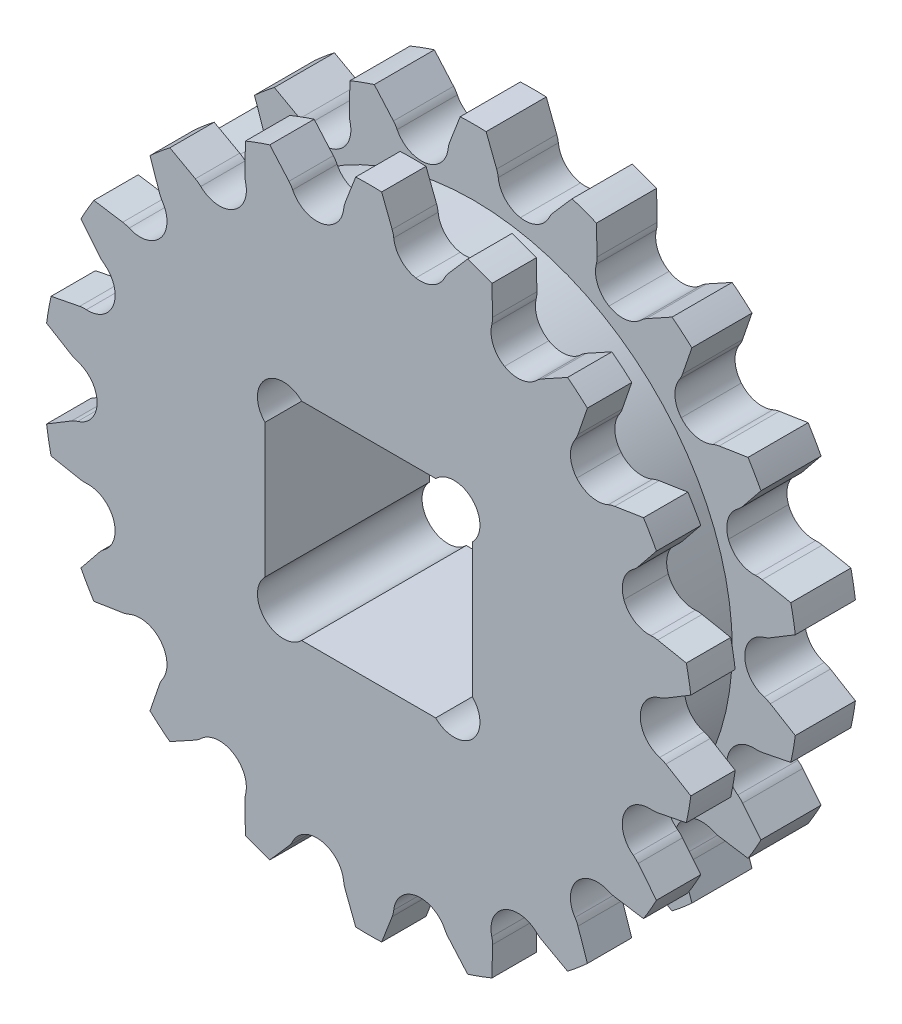
from build123d import *

# Parameters (mm, degrees)
BOSS_EXTRUDE1_DEPTH = 2.7178
SKETCH3_R           = 15.875
BOSS_EXTRUDE2_DEPTH = 3.683
BOSS_EXTRUDE3_START = -7.366
BOSS_EXTRUDE3_DEPTH = 3.683
CUT_EXTRUDE1_DEPTH  = 30.793258251


with BuildPart() as part:
    # Sketch1 → Boss-Extrude1 (new body)
    with BuildSketch(Plane.XY):
        with BuildLine():
            Line((-0.79375, 19.897774396), (-1.436590898, 18.231487888))
            ThreePointArc((-1.436590898, 18.231487888), (-1.498138247, 18.03477884), (-1.533681014, 17.831753627))
            ThreePointArc((-1.533681014, 17.831753627), (-1.969599997, 16.882094075), (-2.888368056, 16.384355312))
            ThreePointArc((-2.888368056, 16.384355312), (-3.922004552, 16.537943659), (-4.656380636, 17.281371903))
            ThreePointArc((-4.656380636, 17.281371903), (-4.759313465, 17.459923199), (-4.884510306, 17.623634786))
            Line((-4.884510306, 17.623634786), (-6.059558633, 18.969270258))
            ThreePointArc((-6.059558633, 18.969270258), (-6.810852326, 18.712662973), (-7.551320668, 18.426313281))
            Line((-7.551320668, 18.426313281), (-7.585489966, 16.640651609))
            ThreePointArc((-7.585489966, 16.640651609), (-7.576047099, 16.434755136), (-7.540007663, 16.231817498))
            ThreePointArc((-7.540007663, 16.231817498), (-7.624834818, 15.190336353), (-8.3179577, 14.408377726))
            ThreePointArc((-8.3179577, 14.408377726), (-9.341788597, 14.199179061), (-10.286143819, 14.646601681))
            ThreePointArc((-10.286143819, 14.646601681), (-10.443937178, 14.779179916), (-10.617576386, 14.890198645))
            Line((-10.617576386, 14.890198645), (-12.181995065, 15.752792171))
            ThreePointArc((-12.181995065, 15.752792171), (-12.800215344, 15.254702622), (-13.398090619, 14.732366841))
            Line((-13.398090619, 14.732366841), (-12.819466994, 13.042707157))
            ThreePointArc((-12.819466994, 13.042707157), (-12.74017286, 12.852457411), (-12.636898109, 12.674084624))
            ThreePointArc((-12.636898109, 12.674084624), (-12.36040203, 11.666399881), (-12.744278886, 10.694537142))
            ThreePointArc((-12.744278886, 10.694537142), (-13.634905925, 10.148174393), (-14.675246249, 10.245235136))
            ThreePointArc((-14.675246249, 10.245235136), (-14.868867931, 10.315849418), (-15.070006055, 10.360784792))
            Line((-15.070006055, 10.360784792), (-16.835103105, 10.636294862))
            ThreePointArc((-16.835103105, 10.636294862), (-17.245683481, 9.9568), (-17.628853105, 9.261479534))
            Line((-17.628853105, 9.261479534), (-16.507227108, 7.871619731))
            ThreePointArc((-16.507227108, 7.871619731), (-16.36764575, 7.71996364), (-16.209592142, 7.587670094))
            ThreePointArc((-16.209592142, 7.587670094), (-15.605122337, 6.735323405), (-15.633451952, 5.690777544))
            ThreePointArc((-15.633451952, 5.690777544), (-16.283500544, 4.872752113), (-17.294297398, 4.608142031))
            ThreePointArc((-17.294297398, 4.608142031), (-17.500393771, 4.608275234), (-17.704770585, 4.581707383))
            Line((-17.704770585, 4.581707383), (-19.457649251, 4.236903417))
            ThreePointArc((-19.457649251, 4.236903417), (-19.61106767, 3.457960351), (-19.733315733, 2.673521109))
            Line((-19.733315733, 2.673521109), (-18.203972012, 1.751098794))
            ThreePointArc((-18.203972012, 1.751098794), (-18.020939002, 1.65632832), (-17.827170135, 1.586070568))
            ThreePointArc((-17.827170135, 1.586070568), (-16.967634583, 0.991867524), (-16.636999988, 0.000626187))
            ThreePointArc((-16.636999988, 0.000626187), (-16.968064677, -0.990395986), (-17.827401045, -1.584761013))
            ThreePointArc((-17.827401045, -1.584761013), (-18.021113843, -1.655124954), (-18.204078487, -1.749991554))
            Line((-18.204078487, -1.749991554), (-19.733315733, -2.673521109))
            ThreePointArc((-19.733315733, -2.673521109), (-19.61106767, -3.457960351), (-19.457649251, -4.236903417))
            Line((-19.457649251, -4.236903417), (-17.705049229, -4.580630502))
            ThreePointArc((-17.705049229, -4.580630502), (-17.500641049, -4.60708464), (-17.294528308, -4.606832476))
            ThreePointArc((-17.294528308, -4.606832476), (-16.283599682, -4.871222219), (-15.63388029, -5.689600697))
            ThreePointArc((-15.63388029, -5.689600697), (-15.606029789, -6.734087713), (-16.21025702, -7.58651849))
            ThreePointArc((-16.21025702, -7.58651849), (-16.368221623, -7.718892645), (-16.50770586, -7.870615683))
            Line((-16.50770586, -7.870615683), (-17.628853105, -9.261479534))
            ThreePointArc((-17.628853105, -9.261479534), (-17.245683481, -9.9568), (-16.835103105, -10.636294862))
            Line((-16.835103105, -10.636294862), (-15.070636211, -10.359868156))
            ThreePointArc((-15.070636211, -10.359868156), (-14.869507504, -10.3148152), (-14.675911128, -10.244083533))
            ThreePointArc((-14.675911128, -10.244083533), (-13.63552234, -10.14677067), (-12.745083897, -10.693577767))
            ThreePointArc((-12.745083897, -10.693577767), (-12.361677388, -11.665549077), (-12.637916762, -12.673229872))
            ThreePointArc((-12.637916762, -12.673229872), (-12.741080306, -12.851647965), (-12.820260279, -13.041927403))
            Line((-12.820260279, -13.041927403), (-13.398090619, -14.732366841))
            ThreePointArc((-13.398090619, -14.732366841), (-12.800215344, -15.254702622), (-12.181995065, -15.752792171))
            Line((-12.181995065, -15.752792171), (-10.618482046, -14.889552815))
            ThreePointArc((-10.618482046, -14.889552815), (-10.444891903, -14.778426816), (-10.287162472, -14.64574693))
            ThreePointArc((-10.287162472, -14.64574693), (-9.342799764, -14.198468829), (-8.319042288, -14.407751539))
            ThreePointArc((-8.319042288, -14.407751539), (-7.626324255, -15.189973057), (-7.541257226, -16.231362695))
            ThreePointArc((-7.541257226, -16.231362695), (-7.577176665, -16.43430487), (-7.586502101, -16.640190199))
            Line((-7.586502101, -16.640190199), (-7.551320668, -18.426313281))
            ThreePointArc((-7.551320668, -18.426313281), (-6.810852326, -18.712662973), (-6.059558633, -18.969270258))
            Line((-6.059558633, -18.969270258), (-4.885582235, -17.623337659))
            ThreePointArc((-4.885582235, -17.623337659), (-4.760468189, -17.459542051), (-4.657630199, -17.280917099))
            ThreePointArc((-4.657630199, -17.280917099), (-3.923197652, -16.537622099), (-2.889601404, -16.384137839))
            ThreePointArc((-2.889601404, -16.384137839), (-1.971123864, -16.882262106), (-1.535010771, -17.831753627))
            ThreePointArc((-1.535010771, -17.831753627), (-1.499353692, -18.034742063), (-1.437699805, -18.231400475))
            Line((-1.437699805, -18.231400475), (-0.79375, -19.897774396))
            ThreePointArc((-0.79375, -19.897774396), (0, -19.9136), (0.79375, -19.897774396))
            Line((0.79375, -19.897774396), (1.436590898, -18.231487888))
            ThreePointArc((1.436590898, -18.231487888), (1.498138247, -18.03477884), (1.533681014, -17.831753627))
            ThreePointArc((1.533681014, -17.831753627), (1.969599997, -16.882094075), (2.888368056, -16.384355312))
            ThreePointArc((2.888368056, -16.384355312), (3.921823156, -16.53830119), (4.656380636, -17.281371903))
            ThreePointArc((4.656380636, -17.281371903), (4.759313465, -17.459923199), (4.884510306, -17.623634786))
            Line((4.884510306, -17.623634786), (6.059558633, -18.969270258))
            ThreePointArc((6.059558633, -18.969270258), (6.810852326, -18.712662973), (7.551320668, -18.426313281))
            Line((7.551320668, -18.426313281), (7.585489966, -16.640651609))
            ThreePointArc((7.585489966, -16.640651609), (7.576047099, -16.434755136), (7.540007663, -16.231817498))
            ThreePointArc((7.540007663, -16.231817498), (7.624834818, -15.190336353), (8.3179577, -14.408377726))
            ThreePointArc((8.3179577, -14.408377726), (9.341740423, -14.199577071), (10.286143819, -14.646601681))
            ThreePointArc((10.286143819, -14.646601681), (10.443937178, -14.779179916), (10.617576386, -14.890198645))
            Line((10.617576386, -14.890198645), (12.181995065, -15.752792171))
            ThreePointArc((12.181995065, -15.752792171), (12.800215344, -15.254702622), (13.398090619, -14.732366841))
            Line((13.398090619, -14.732366841), (12.819466994, -13.042707157))
            ThreePointArc((12.819466994, -13.042707157), (12.74017286, -12.852457411), (12.636898109, -12.674084624))
            ThreePointArc((12.636898109, -12.674084624), (12.36040203, -11.666399881), (12.744278886, -10.694537142))
            ThreePointArc((12.744278886, -10.694537142), (13.634905925, -10.148174393), (14.675246249, -10.245235136))
            ThreePointArc((14.675246249, -10.245235136), (14.868867931, -10.315849418), (15.070006055, -10.360784792))
            Line((15.070006055, -10.360784792), (16.835103105, -10.636294862))
            ThreePointArc((16.835103105, -10.636294862), (17.245683481, -9.9568), (17.628853105, -9.261479534))
            Line((17.628853105, -9.261479534), (16.507227108, -7.871619731))
            ThreePointArc((16.507227108, -7.871619731), (16.36764575, -7.71996364), (16.209592142, -7.587670094))
            ThreePointArc((16.209592142, -7.587670094), (15.605122337, -6.735323405), (15.633451952, -5.690777544))
            ThreePointArc((15.633451952, -5.690777544), (16.283281611, -4.872416254), (17.294297398, -4.608142031))
            ThreePointArc((17.294297398, -4.608142031), (17.500393771, -4.608275234), (17.704770585, -4.581707383))
            Line((17.704770585, -4.581707383), (19.457649251, -4.236903417))
            ThreePointArc((19.457649251, -4.236903417), (19.61106767, -3.457960351), (19.733315733, -2.673521109))
            Line((19.733315733, -2.673521109), (18.203972012, -1.751098794))
            ThreePointArc((18.203972012, -1.751098794), (18.020939002, -1.65632832), (17.827170135, -1.586070568))
            ThreePointArc((17.827170135, -1.586070568), (16.967634583, -0.991867524), (16.636999988, -0.000626187))
            ThreePointArc((16.636999988, -0.000626187), (16.967744078, 0.990636711), (17.827401045, 1.584761013))
            ThreePointArc((17.827401045, 1.584761013), (18.021113843, 1.655124954), (18.204078487, 1.749991554))
            Line((18.204078487, 1.749991554), (19.733315733, 2.673521109))
            ThreePointArc((19.733315733, 2.673521109), (19.61106767, 3.457960351), (19.457649251, 4.236903417))
            Line((19.457649251, 4.236903417), (17.705049229, 4.580630502))
            ThreePointArc((17.705049229, 4.580630502), (17.500641049, 4.60708464), (17.294528308, 4.606832476))
            ThreePointArc((17.294528308, 4.606832476), (16.283599682, 4.871222219), (15.63388029, 5.689600697))
            ThreePointArc((15.63388029, 5.689600697), (15.606029789, 6.734087713), (16.21025702, 7.58651849))
            ThreePointArc((16.21025702, 7.58651849), (16.368221623, 7.718892645), (16.50770586, 7.870615683))
            Line((16.50770586, 7.870615683), (17.628853105, 9.261479534))
            ThreePointArc((17.628853105, 9.261479534), (17.245683481, 9.9568), (16.835103105, 10.636294862))
            Line((16.835103105, 10.636294862), (15.070636211, 10.359868156))
            ThreePointArc((15.070636211, 10.359868156), (14.869507504, 10.3148152), (14.675911128, 10.244083533))
            ThreePointArc((14.675911128, 10.244083533), (13.63552234, 10.14677067), (12.745083897, 10.693577767))
            ThreePointArc((12.745083897, 10.693577767), (12.361677388, 11.665549077), (12.637916762, 12.673229872))
            ThreePointArc((12.637916762, 12.673229872), (12.741080306, 12.851647965), (12.820260279, 13.041927403))
            Line((12.820260279, 13.041927403), (13.398090619, 14.732366841))
            ThreePointArc((13.398090619, 14.732366841), (12.800215344, 15.254702622), (12.181995065, 15.752792171))
            Line((12.181995065, 15.752792171), (10.618482046, 14.889552815))
            ThreePointArc((10.618482046, 14.889552815), (10.444891903, 14.778426816), (10.287162472, 14.64574693))
            ThreePointArc((10.287162472, 14.64574693), (9.342799764, 14.198468829), (8.319042288, 14.407751539))
            ThreePointArc((8.319042288, 14.407751539), (7.626324255, 15.189973057), (7.541257226, 16.231362695))
            ThreePointArc((7.541257226, 16.231362695), (7.577176665, 16.43430487), (7.586502101, 16.640190199))
            Line((7.586502101, 16.640190199), (7.551320668, 18.426313281))
            ThreePointArc((7.551320668, 18.426313281), (6.810852326, 18.712662973), (6.059558633, 18.969270258))
            Line((6.059558633, 18.969270258), (4.885582235, 17.623337659))
            ThreePointArc((4.885582235, 17.623337659), (4.760468189, 17.459542051), (4.657630199, 17.280917099))
            ThreePointArc((4.657630199, 17.280917099), (3.923197652, 16.537622099), (2.889601404, 16.384137839))
            ThreePointArc((2.889601404, 16.384137839), (1.971123864, 16.882262106), (1.535010771, 17.831753627))
            ThreePointArc((1.535010771, 17.831753627), (1.499353692, 18.034742063), (1.437699805, 18.231400475))
            Line((1.437699805, 18.231400475), (0.79375, 19.897774396))
            ThreePointArc((0.79375, 19.897774396), (0, 19.9136), (-0.79375, 19.897774396))
        make_face()
    extrude(amount=BOSS_EXTRUDE1_DEPTH)

    # Sketch3 → Boss-Extrude2 (add)
    with BuildSketch(Plane(origin=(0, 0, 0), x_dir=(-1, 0, 0), z_dir=(0, 0, -1))):
        with Locations(Location((0, 0, 0), (0, 0, 180))):
            Circle(SKETCH3_R)
    extrude(amount=BOSS_EXTRUDE2_DEPTH)

    # Sketch1<2> → Boss-Extrude3 (add)
    with BuildSketch(Plane.XY.offset(BOSS_EXTRUDE3_START)):
        with BuildLine():
            Line((-0.79375, 19.897774396), (-1.436590898, 18.231487888))
            ThreePointArc((-1.436590898, 18.231487888), (-1.498138247, 18.03477884), (-1.533681014, 17.831753627))
            ThreePointArc((-1.533681014, 17.831753627), (-1.969599997, 16.882094075), (-2.888368056, 16.384355312))
            ThreePointArc((-2.888368056, 16.384355312), (-3.922004552, 16.537943659), (-4.656380636, 17.281371903))
            ThreePointArc((-4.656380636, 17.281371903), (-4.759313465, 17.459923199), (-4.884510306, 17.623634786))
            Line((-4.884510306, 17.623634786), (-6.059558633, 18.969270258))
            ThreePointArc((-6.059558633, 18.969270258), (-6.810852326, 18.712662973), (-7.551320668, 18.426313281))
            Line((-7.551320668, 18.426313281), (-7.585489966, 16.640651609))
            ThreePointArc((-7.585489966, 16.640651609), (-7.576047099, 16.434755136), (-7.540007663, 16.231817498))
            ThreePointArc((-7.540007663, 16.231817498), (-7.624834818, 15.190336353), (-8.3179577, 14.408377726))
            ThreePointArc((-8.3179577, 14.408377726), (-9.341788597, 14.199179061), (-10.286143819, 14.646601681))
            ThreePointArc((-10.286143819, 14.646601681), (-10.443937178, 14.779179916), (-10.617576386, 14.890198645))
            Line((-10.617576386, 14.890198645), (-12.181995065, 15.752792171))
            ThreePointArc((-12.181995065, 15.752792171), (-12.800215344, 15.254702622), (-13.398090619, 14.732366841))
            Line((-13.398090619, 14.732366841), (-12.819466994, 13.042707157))
            ThreePointArc((-12.819466994, 13.042707157), (-12.74017286, 12.852457411), (-12.636898109, 12.674084624))
            ThreePointArc((-12.636898109, 12.674084624), (-12.36040203, 11.666399881), (-12.744278886, 10.694537142))
            ThreePointArc((-12.744278886, 10.694537142), (-13.634905925, 10.148174393), (-14.675246249, 10.245235136))
            ThreePointArc((-14.675246249, 10.245235136), (-14.868867931, 10.315849418), (-15.070006055, 10.360784792))
            Line((-15.070006055, 10.360784792), (-16.835103105, 10.636294862))
            ThreePointArc((-16.835103105, 10.636294862), (-17.245683481, 9.9568), (-17.628853105, 9.261479534))
            Line((-17.628853105, 9.261479534), (-16.507227108, 7.871619731))
            ThreePointArc((-16.507227108, 7.871619731), (-16.36764575, 7.71996364), (-16.209592142, 7.587670094))
            ThreePointArc((-16.209592142, 7.587670094), (-15.605122337, 6.735323405), (-15.633451952, 5.690777544))
            ThreePointArc((-15.633451952, 5.690777544), (-16.283500544, 4.872752113), (-17.294297398, 4.608142031))
            ThreePointArc((-17.294297398, 4.608142031), (-17.500393771, 4.608275234), (-17.704770585, 4.581707383))
            Line((-17.704770585, 4.581707383), (-19.457649251, 4.236903417))
            ThreePointArc((-19.457649251, 4.236903417), (-19.61106767, 3.457960351), (-19.733315733, 2.673521109))
            Line((-19.733315733, 2.673521109), (-18.203972012, 1.751098794))
            ThreePointArc((-18.203972012, 1.751098794), (-18.020939002, 1.65632832), (-17.827170135, 1.586070568))
            ThreePointArc((-17.827170135, 1.586070568), (-16.967634583, 0.991867524), (-16.636999988, 0.000626187))
            ThreePointArc((-16.636999988, 0.000626187), (-16.968064677, -0.990395986), (-17.827401045, -1.584761013))
            ThreePointArc((-17.827401045, -1.584761013), (-18.021113843, -1.655124954), (-18.204078487, -1.749991554))
            Line((-18.204078487, -1.749991554), (-19.733315733, -2.673521109))
            ThreePointArc((-19.733315733, -2.673521109), (-19.61106767, -3.457960351), (-19.457649251, -4.236903417))
            Line((-19.457649251, -4.236903417), (-17.705049229, -4.580630502))
            ThreePointArc((-17.705049229, -4.580630502), (-17.500641049, -4.60708464), (-17.294528308, -4.606832476))
            ThreePointArc((-17.294528308, -4.606832476), (-16.283599682, -4.871222219), (-15.63388029, -5.689600697))
            ThreePointArc((-15.63388029, -5.689600697), (-15.606029789, -6.734087713), (-16.21025702, -7.58651849))
            ThreePointArc((-16.21025702, -7.58651849), (-16.368221623, -7.718892645), (-16.50770586, -7.870615683))
            Line((-16.50770586, -7.870615683), (-17.628853105, -9.261479534))
            ThreePointArc((-17.628853105, -9.261479534), (-17.245683481, -9.9568), (-16.835103105, -10.636294862))
            Line((-16.835103105, -10.636294862), (-15.070636211, -10.359868156))
            ThreePointArc((-15.070636211, -10.359868156), (-14.869507504, -10.3148152), (-14.675911128, -10.244083533))
            ThreePointArc((-14.675911128, -10.244083533), (-13.63552234, -10.14677067), (-12.745083897, -10.693577767))
            ThreePointArc((-12.745083897, -10.693577767), (-12.361677388, -11.665549077), (-12.637916762, -12.673229872))
            ThreePointArc((-12.637916762, -12.673229872), (-12.741080306, -12.851647965), (-12.820260279, -13.041927403))
            Line((-12.820260279, -13.041927403), (-13.398090619, -14.732366841))
            ThreePointArc((-13.398090619, -14.732366841), (-12.800215344, -15.254702622), (-12.181995065, -15.752792171))
            Line((-12.181995065, -15.752792171), (-10.618482046, -14.889552815))
            ThreePointArc((-10.618482046, -14.889552815), (-10.444891903, -14.778426816), (-10.287162472, -14.64574693))
            ThreePointArc((-10.287162472, -14.64574693), (-9.342799764, -14.198468829), (-8.319042288, -14.407751539))
            ThreePointArc((-8.319042288, -14.407751539), (-7.626324255, -15.189973057), (-7.541257226, -16.231362695))
            ThreePointArc((-7.541257226, -16.231362695), (-7.577176665, -16.43430487), (-7.586502101, -16.640190199))
            Line((-7.586502101, -16.640190199), (-7.551320668, -18.426313281))
            ThreePointArc((-7.551320668, -18.426313281), (-6.810852326, -18.712662973), (-6.059558633, -18.969270258))
            Line((-6.059558633, -18.969270258), (-4.885582235, -17.623337659))
            ThreePointArc((-4.885582235, -17.623337659), (-4.760468189, -17.459542051), (-4.657630199, -17.280917099))
            ThreePointArc((-4.657630199, -17.280917099), (-3.923197652, -16.537622099), (-2.889601404, -16.384137839))
            ThreePointArc((-2.889601404, -16.384137839), (-1.971123864, -16.882262106), (-1.535010771, -17.831753627))
            ThreePointArc((-1.535010771, -17.831753627), (-1.499353692, -18.034742063), (-1.437699805, -18.231400475))
            Line((-1.437699805, -18.231400475), (-0.79375, -19.897774396))
            ThreePointArc((-0.79375, -19.897774396), (0, -19.9136), (0.79375, -19.897774396))
            Line((0.79375, -19.897774396), (1.436590898, -18.231487888))
            ThreePointArc((1.436590898, -18.231487888), (1.498138247, -18.03477884), (1.533681014, -17.831753627))
            ThreePointArc((1.533681014, -17.831753627), (1.969599997, -16.882094075), (2.888368056, -16.384355312))
            ThreePointArc((2.888368056, -16.384355312), (3.921823156, -16.53830119), (4.656380636, -17.281371903))
            ThreePointArc((4.656380636, -17.281371903), (4.759313465, -17.459923199), (4.884510306, -17.623634786))
            Line((4.884510306, -17.623634786), (6.059558633, -18.969270258))
            ThreePointArc((6.059558633, -18.969270258), (6.810852326, -18.712662973), (7.551320668, -18.426313281))
            Line((7.551320668, -18.426313281), (7.585489966, -16.640651609))
            ThreePointArc((7.585489966, -16.640651609), (7.576047099, -16.434755136), (7.540007663, -16.231817498))
            ThreePointArc((7.540007663, -16.231817498), (7.624834818, -15.190336353), (8.3179577, -14.408377726))
            ThreePointArc((8.3179577, -14.408377726), (9.341740423, -14.199577071), (10.286143819, -14.646601681))
            ThreePointArc((10.286143819, -14.646601681), (10.443937178, -14.779179916), (10.617576386, -14.890198645))
            Line((10.617576386, -14.890198645), (12.181995065, -15.752792171))
            ThreePointArc((12.181995065, -15.752792171), (12.800215344, -15.254702622), (13.398090619, -14.732366841))
            Line((13.398090619, -14.732366841), (12.819466994, -13.042707157))
            ThreePointArc((12.819466994, -13.042707157), (12.74017286, -12.852457411), (12.636898109, -12.674084624))
            ThreePointArc((12.636898109, -12.674084624), (12.36040203, -11.666399881), (12.744278886, -10.694537142))
            ThreePointArc((12.744278886, -10.694537142), (13.634905925, -10.148174393), (14.675246249, -10.245235136))
            ThreePointArc((14.675246249, -10.245235136), (14.868867931, -10.315849418), (15.070006055, -10.360784792))
            Line((15.070006055, -10.360784792), (16.835103105, -10.636294862))
            ThreePointArc((16.835103105, -10.636294862), (17.245683481, -9.9568), (17.628853105, -9.261479534))
            Line((17.628853105, -9.261479534), (16.507227108, -7.871619731))
            ThreePointArc((16.507227108, -7.871619731), (16.36764575, -7.71996364), (16.209592142, -7.587670094))
            ThreePointArc((16.209592142, -7.587670094), (15.605122337, -6.735323405), (15.633451952, -5.690777544))
            ThreePointArc((15.633451952, -5.690777544), (16.283281611, -4.872416254), (17.294297398, -4.608142031))
            ThreePointArc((17.294297398, -4.608142031), (17.500393771, -4.608275234), (17.704770585, -4.581707383))
            Line((17.704770585, -4.581707383), (19.457649251, -4.236903417))
            ThreePointArc((19.457649251, -4.236903417), (19.61106767, -3.457960351), (19.733315733, -2.673521109))
            Line((19.733315733, -2.673521109), (18.203972012, -1.751098794))
            ThreePointArc((18.203972012, -1.751098794), (18.020939002, -1.65632832), (17.827170135, -1.586070568))
            ThreePointArc((17.827170135, -1.586070568), (16.967634583, -0.991867524), (16.636999988, -0.000626187))
            ThreePointArc((16.636999988, -0.000626187), (16.967744078, 0.990636711), (17.827401045, 1.584761013))
            ThreePointArc((17.827401045, 1.584761013), (18.021113843, 1.655124954), (18.204078487, 1.749991554))
            Line((18.204078487, 1.749991554), (19.733315733, 2.673521109))
            ThreePointArc((19.733315733, 2.673521109), (19.61106767, 3.457960351), (19.457649251, 4.236903417))
            Line((19.457649251, 4.236903417), (17.705049229, 4.580630502))
            ThreePointArc((17.705049229, 4.580630502), (17.500641049, 4.60708464), (17.294528308, 4.606832476))
            ThreePointArc((17.294528308, 4.606832476), (16.283599682, 4.871222219), (15.63388029, 5.689600697))
            ThreePointArc((15.63388029, 5.689600697), (15.606029789, 6.734087713), (16.21025702, 7.58651849))
            ThreePointArc((16.21025702, 7.58651849), (16.368221623, 7.718892645), (16.50770586, 7.870615683))
            Line((16.50770586, 7.870615683), (17.628853105, 9.261479534))
            ThreePointArc((17.628853105, 9.261479534), (17.245683481, 9.9568), (16.835103105, 10.636294862))
            Line((16.835103105, 10.636294862), (15.070636211, 10.359868156))
            ThreePointArc((15.070636211, 10.359868156), (14.869507504, 10.3148152), (14.675911128, 10.244083533))
            ThreePointArc((14.675911128, 10.244083533), (13.63552234, 10.14677067), (12.745083897, 10.693577767))
            ThreePointArc((12.745083897, 10.693577767), (12.361677388, 11.665549077), (12.637916762, 12.673229872))
            ThreePointArc((12.637916762, 12.673229872), (12.741080306, 12.851647965), (12.820260279, 13.041927403))
            Line((12.820260279, 13.041927403), (13.398090619, 14.732366841))
            ThreePointArc((13.398090619, 14.732366841), (12.800215344, 15.254702622), (12.181995065, 15.752792171))
            Line((12.181995065, 15.752792171), (10.618482046, 14.889552815))
            ThreePointArc((10.618482046, 14.889552815), (10.444891903, 14.778426816), (10.287162472, 14.64574693))
            ThreePointArc((10.287162472, 14.64574693), (9.342799764, 14.198468829), (8.319042288, 14.407751539))
            ThreePointArc((8.319042288, 14.407751539), (7.626324255, 15.189973057), (7.541257226, 16.231362695))
            ThreePointArc((7.541257226, 16.231362695), (7.577176665, 16.43430487), (7.586502101, 16.640190199))
            Line((7.586502101, 16.640190199), (7.551320668, 18.426313281))
            ThreePointArc((7.551320668, 18.426313281), (6.810852326, 18.712662973), (6.059558633, 18.969270258))
            Line((6.059558633, 18.969270258), (4.885582235, 17.623337659))
            ThreePointArc((4.885582235, 17.623337659), (4.760468189, 17.459542051), (4.657630199, 17.280917099))
            ThreePointArc((4.657630199, 17.280917099), (3.923197652, 16.537622099), (2.889601404, 16.384137839))
            ThreePointArc((2.889601404, 16.384137839), (1.971123864, 16.882262106), (1.535010771, 17.831753627))
            ThreePointArc((1.535010771, 17.831753627), (1.499353692, 18.034742063), (1.437699805, 18.231400475))
            Line((1.437699805, 18.231400475), (0.79375, 19.897774396))
            ThreePointArc((0.79375, 19.897774396), (0, 19.9136), (-0.79375, 19.897774396))
        make_face()
    extrude(amount=BOSS_EXTRUDE3_DEPTH)

    # Sketch2 → Cut-Extrude1 (cut, through all)
    with BuildSketch(Plane.XY.offset(2.7178)):
        with BuildLine():
            Line((-4.10493597, 6.35), (4.10493597, 6.35))
            ThreePointArc((4.10493597, 6.35), (6.35, 6.35), (6.35, 4.10493597))
            Line((6.35, 4.10493597), (6.35, -4.10493597))
            ThreePointArc((6.35, -4.10493597), (6.35, -6.35), (4.10493597, -6.35))
            Line((4.10493597, -6.35), (-4.10493597, -6.35))
            ThreePointArc((-4.10493597, -6.35), (-6.35, -6.35), (-6.35, -4.10493597))
            Line((-6.35, -4.10493597), (-6.35, 4.10493597))
            ThreePointArc((-6.35, 4.10493597), (-6.35, 6.35), (-4.10493597, 6.35))
        make_face()
    extrude(amount=-CUT_EXTRUDE1_DEPTH, mode=Mode.SUBTRACT)


solid = part.part
